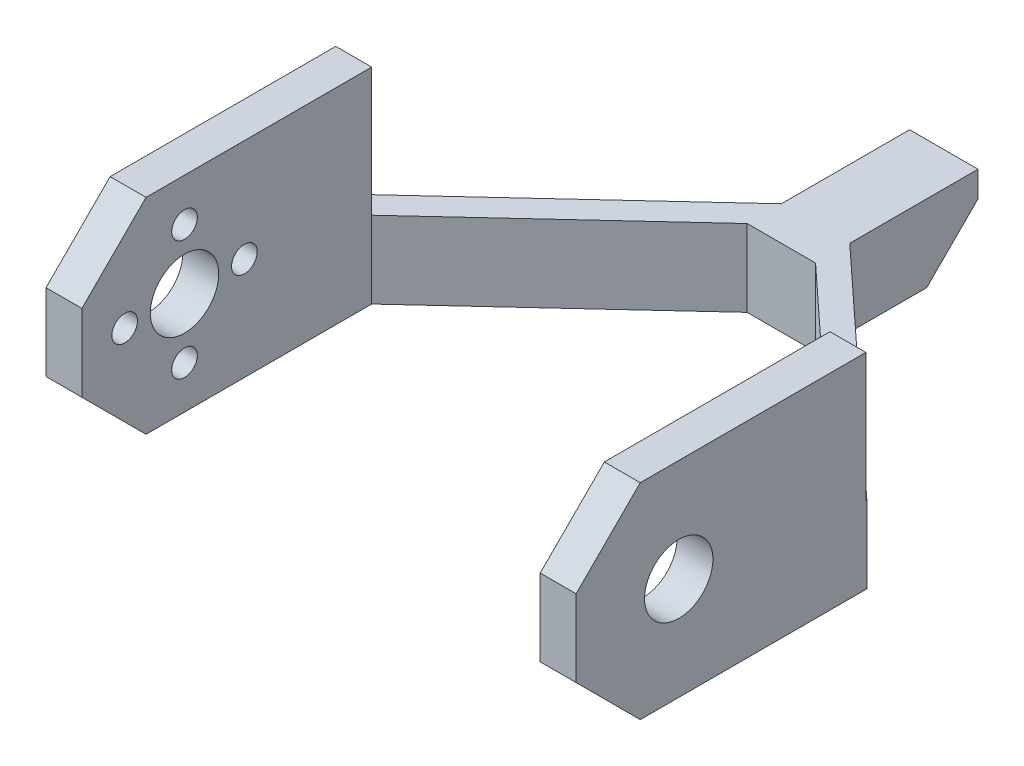
from build123d import *

# Parameters (mm, degrees)
BOSS_EXTRUDE1_DEPTH = 62
CUT_EXTRUDE1_REACH  = 83.419
BOSS_EXTRUDE2_START = -15
SKETCH9_W           = 8
SKETCH9_H           = 15
BOSS_EXTRUDE2_DEPTH = 9
SKETCH7_R           = 4
CUT_EXTRUDE4_DEPTH  = 70
CUT_EXTRUDE5_REACH  = 90.499
SKETCH8_R           = 1.5
CHAMFER1_SIZE       = 7.5
CUT_EXTRUDE6_DEPTH  = 15
CHAMFER2_SIZE       = 6


with BuildPart() as part:
    # Sketch1 → Boss-Extrude1 (new body)
    with BuildSketch(Plane(origin=(0, 0, 0), x_dir=(0, 0, -1), z_dir=(1, 0, 0))):
        Polygon((-12, 12), (-12, -12), (12, -12), (47, -12), (47, 12), (12, 12), align=None)
    extrude(amount=-BOSS_EXTRUDE1_DEPTH)

    # Sketch2 → Cut-Extrude1 (cut, up to next)
    with BuildSketch(Plane(origin=(0, 12, 0), x_dir=(1, 0, 0), z_dir=(0, 1, 0)), mode=Mode.PRIVATE) as cut_extrude1_sk1:
        Polygon((-57.8, -12), (-57.8, 21.888888889), (-35, 43), (-27, 43), (-4.2, 21.888888889), (-4.2, -12), align=None)
    cut_extrude1_tool1 = extrude(cut_extrude1_sk1.sketch, amount=-CUT_EXTRUDE1_REACH, mode=Mode.PRIVATE) & part.part
    # Sketch2 → Cut-Extrude1 (cut, up to next)
    with BuildSketch(Plane(origin=(0, 12, 0), x_dir=(1, 0, 0), z_dir=(0, 1, 0)), mode=Mode.PRIVATE) as cut_extrude1_sk2:
        Polygon((-62, 22), (-62, 47), (-35, 47), align=None)
    cut_extrude1_tool2 = extrude(cut_extrude1_sk2.sketch, amount=-CUT_EXTRUDE1_REACH, mode=Mode.PRIVATE) & part.part
    # Sketch2 → Cut-Extrude1 (cut, up to next)
    with BuildSketch(Plane(origin=(0, 12, 0), x_dir=(1, 0, 0), z_dir=(0, 1, 0)), mode=Mode.PRIVATE) as cut_extrude1_sk3:
        Polygon((-27, 47), (0, 47), (0, 22), align=None)
    cut_extrude1_tool3 = extrude(cut_extrude1_sk3.sketch, amount=-CUT_EXTRUDE1_REACH, mode=Mode.PRIVATE) & part.part
    add(cut_extrude1_tool1.solids().sort_by_distance((-31, 12, -11.506957))[0], mode=Mode.SUBTRACT)
    add(cut_extrude1_tool2.solids().sort_by_distance((-53, 12, -38.666667))[0], mode=Mode.SUBTRACT)
    add(cut_extrude1_tool3.solids().sort_by_distance((-9, 12, -38.666667))[0], mode=Mode.SUBTRACT)

    # Sketch9 → Boss-Extrude2 (add)
    with BuildSketch(Plane(origin=(0, 12, 0), x_dir=(1, 0, 0), z_dir=(0, 1, 0)).offset(BOSS_EXTRUDE2_START)):
        with Locations((-31, 54.5)):
            Rectangle(SKETCH9_W, SKETCH9_H)
    extrude(amount=-BOSS_EXTRUDE2_DEPTH)

    # Sketch7 → Cut-Extrude4 (cut)
    with BuildSketch(Plane(origin=(0, 0, 0), x_dir=(0, 0, -1), z_dir=(1, 0, 0))):
        Circle(SKETCH7_R)
    extrude(amount=-CUT_EXTRUDE4_DEPTH, mode=Mode.SUBTRACT)

    # Sketch8 → Cut-Extrude5 (cut, up to next)
    with BuildSketch(Plane.ZY.offset(62), mode=Mode.PRIVATE) as cut_extrude5_sk1:
        with Locations((0, 7)):
            Circle(SKETCH8_R)
    cut_extrude5_tool1 = extrude(cut_extrude5_sk1.sketch, amount=-CUT_EXTRUDE5_REACH, mode=Mode.PRIVATE) & part.part
    # Sketch8 → Cut-Extrude5 (cut, up to next)
    with BuildSketch(Plane.ZY.offset(62), mode=Mode.PRIVATE) as cut_extrude5_sk2:
        with Locations((7, 0)):
            Circle(SKETCH8_R)
    cut_extrude5_tool2 = extrude(cut_extrude5_sk2.sketch, amount=-CUT_EXTRUDE5_REACH, mode=Mode.PRIVATE) & part.part
    # Sketch8 → Cut-Extrude5 (cut, up to next)
    with BuildSketch(Plane.ZY.offset(62), mode=Mode.PRIVATE) as cut_extrude5_sk3:
        with Locations((0, -7)):
            Circle(SKETCH8_R)
    cut_extrude5_tool3 = extrude(cut_extrude5_sk3.sketch, amount=-CUT_EXTRUDE5_REACH, mode=Mode.PRIVATE) & part.part
    # Sketch8 → Cut-Extrude5 (cut, up to next)
    with BuildSketch(Plane.ZY.offset(62), mode=Mode.PRIVATE) as cut_extrude5_sk4:
        with Locations((-7, 0)):
            Circle(SKETCH8_R)
    cut_extrude5_tool4 = extrude(cut_extrude5_sk4.sketch, amount=-CUT_EXTRUDE5_REACH, mode=Mode.PRIVATE) & part.part
    add(cut_extrude5_tool1.solids().sort_by_distance((-62, 7, 0))[0], mode=Mode.SUBTRACT)
    add(cut_extrude5_tool2.solids().sort_by_distance((-62, 0, 7))[0], mode=Mode.SUBTRACT)
    add(cut_extrude5_tool3.solids().sort_by_distance((-62, -7, 0))[0], mode=Mode.SUBTRACT)
    add(cut_extrude5_tool4.solids().sort_by_distance((-62, 0, -7))[0], mode=Mode.SUBTRACT)

    # Chamfer1
    chamfer1_edges = [part.edges().sort_by_distance(p)[0] for p in [
        (-59.9, -12, 12),
        (-59.9, 12, 12),
        (-2.1, 12, 12),
        (-2.1, -12, 12),
    ]]
    chamfer(chamfer1_edges, length=CHAMFER1_SIZE)

    # Sketch10 → Cut-Extrude6 (cut)
    with BuildSketch(Plane(origin=(0, 12, 0), x_dir=(1, 0, 0), z_dir=(0, 1, 0))):
        Polygon((-62, 22), (-35, 47), (-27, 47), (0, 22), (0, 21.888888889), (-4.2, 21.888888889), (-27, 43), (-35, 43), (-57.8, 21.888888889), (-62, 21.888888889), align=None)
    extrude(amount=-CUT_EXTRUDE6_DEPTH, mode=Mode.SUBTRACT)

    # Chamfer2
    chamfer2_edges = [part.edges().sort_by_distance(p)[0] for p in [
        (-31, -12, -62),
    ]]
    chamfer(chamfer2_edges, length=CHAMFER2_SIZE)


solid = part.part
